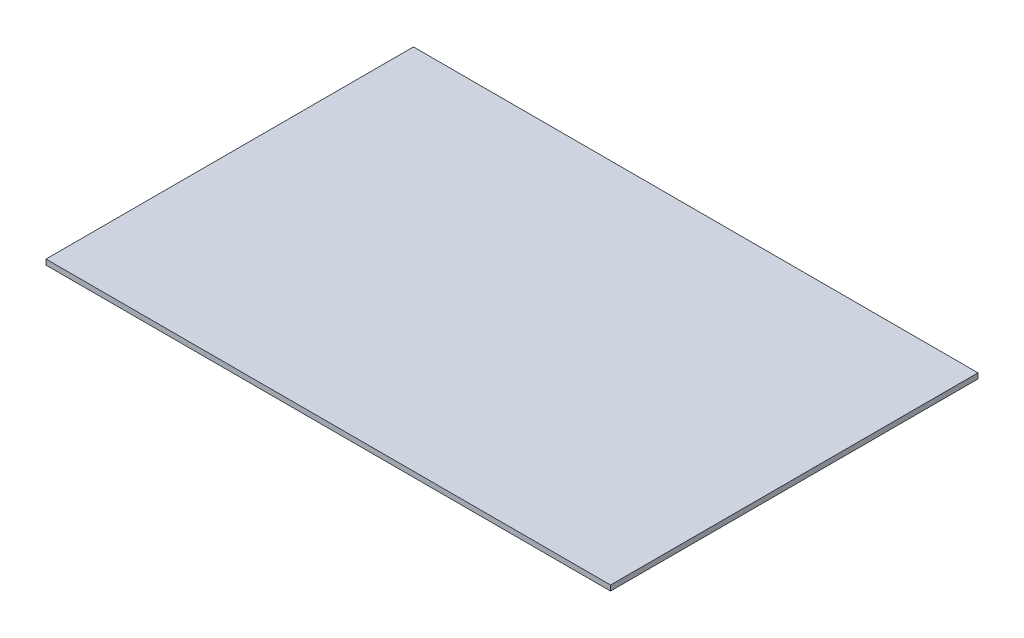
from build123d import *

# Parameters (mm, degrees)
SKETCH_1_W      = 320
SKETCH_1_H      = 208.28
EXTRUDE_1_DEPTH = 3


with BuildPart() as part:
    # 草图1 → 凸台-拉伸1 (new body)
    with BuildSketch(Plane(origin=(0, 0, 0), x_dir=(1, 0, 0), z_dir=(0, 1, 0))):
        Rectangle(SKETCH_1_W, SKETCH_1_H)
    extrude(amount=EXTRUDE_1_DEPTH)


solid = part.part
